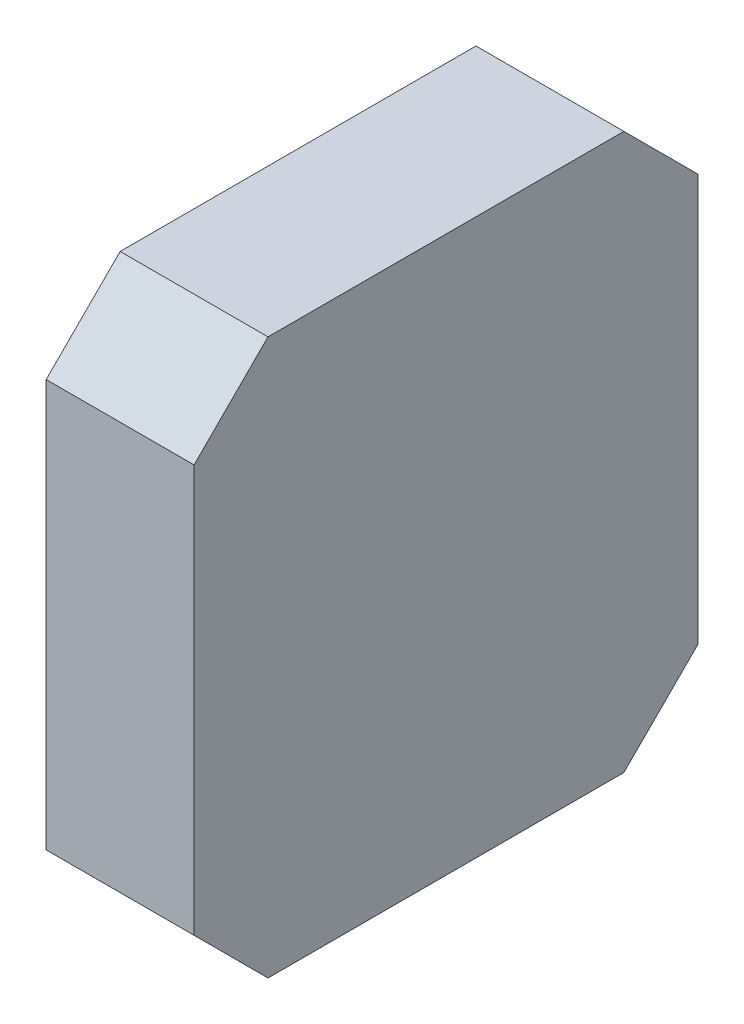
from build123d import *

# Parameters (mm, degrees)
SKETCH3_W           = 136.24
SKETCH3_H           = 150.17
BOSS_EXTRUDE1_DEPTH = 30
CUT_EXTRUDE1_DEPTH  = 30
BOSS_EXTRUDE2_DEPTH = 10


with BuildPart() as part:
    # Sketch3 → Boss-Extrude1 (new body)
    with BuildSketch(Plane(origin=(0, 0, 0), x_dir=(0, 0, -1), z_dir=(1, 0, 0))):
        Rectangle(SKETCH3_W, SKETCH3_H)
    extrude(amount=BOSS_EXTRUDE1_DEPTH)

    # Sketch4 → Cut-Extrude1 (cut)
    with BuildSketch(Plane.ZY):
        Polygon((-68.12, 75.085), (-48.12, 75.085), (-68.12, 55.085), align=None)
        Polygon((68.12, 75.085), (68.12, 55.085), (48.12, 75.085), align=None)
        Polygon((-68.12, -75.085), (-68.12, -55.085), (-48.12, -75.085), align=None)
        Polygon((68.12, -75.085), (68.12, -55.085), (48.12, -75.085), align=None)
        Polygon((25.49577004, -20), (29.49577004, -20), (29.49577004, -40), (25.49577004, -40), (-4.50422996, -40), (-4.50422996, -20), align=None)
    extrude(amount=-CUT_EXTRUDE1_DEPTH, mode=Mode.SUBTRACT)

    # Sketch6 → Boss-Extrude2 (add)
    with BuildSketch(Plane(origin=(30, 0, 0), x_dir=(0, 0, -1), z_dir=(1, 0, 0))):
        Polygon((-68.12, 55.085), (-48.12, 75.085), (48.12, 75.085), (68.12, 55.085), (68.12, -55.085), (48.12, -75.085), (-48.12, -75.085), (-68.12, -55.085), align=None)
    extrude(amount=BOSS_EXTRUDE2_DEPTH)


solid = part.part
